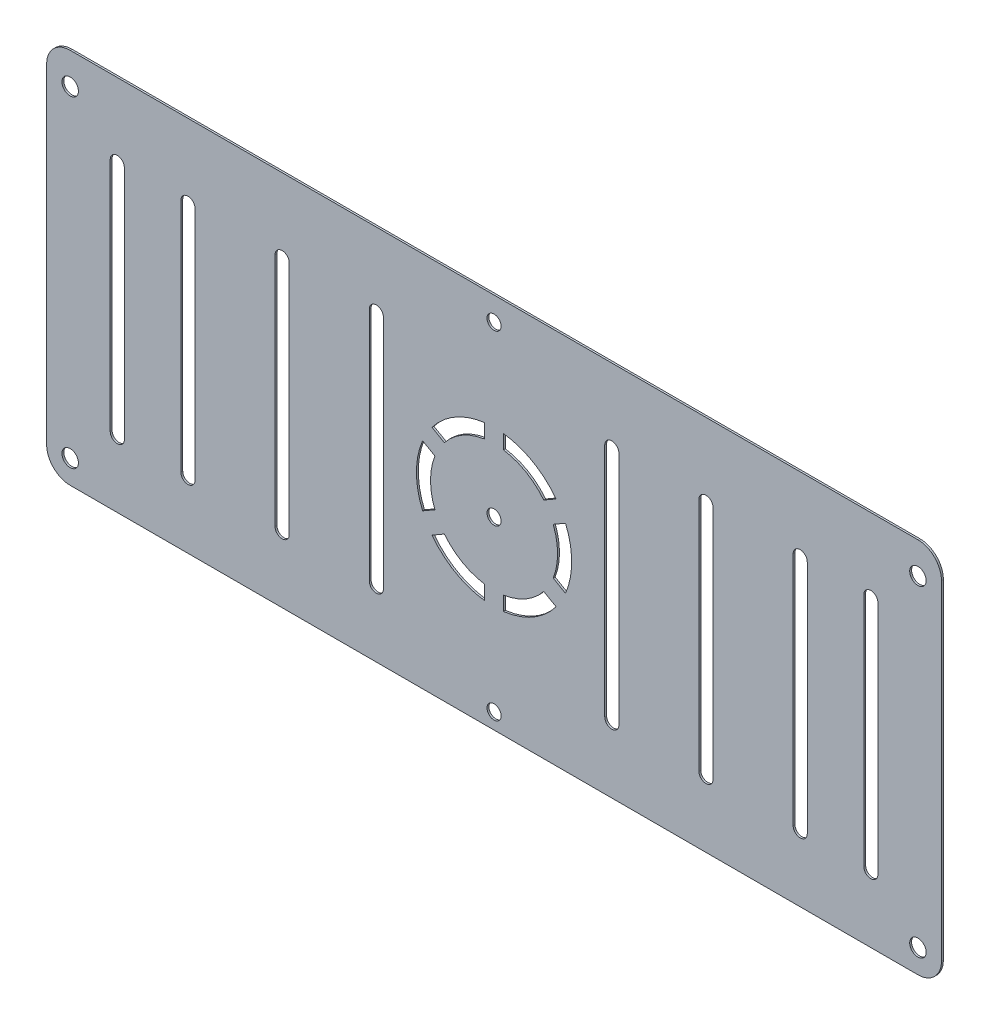
from build123d import *

# Parameters (mm, degrees)
SKETCH_1_R          = 1.75
SKETCH_1_R_2        = 1.5
EXTRUDE_1_DEPTH     = 0.4
SKETCH_2_R          = 1.5
CUT_EXTRUDE_1_DEPTH = 10


with BuildPart() as part:
    # 草图1 → 凸台-拉伸1 (new body)
    with BuildSketch(Plane.XY):
        with BuildLine():
            Line((90, 40.82885301), (-90, 40.82885301))
            ThreePointArc((-90, 40.82885301), (-93.535533906, 39.364386916), (-95, 35.82885301))
            Line((-95, 35.82885301), (-95, -34.17114699))
            ThreePointArc((-95, -34.17114699), (-93.535533906, -37.706680896), (-90, -39.17114699))
            Line((-90, -39.17114699), (90, -39.17114699))
            ThreePointArc((90, -39.17114699), (93.535533906, -37.706680896), (95, -34.17114699))
            Line((95, -34.17114699), (95, 35.82885301))
            ThreePointArc((95, 35.82885301), (93.535533906, 39.364386916), (90, 40.82885301))
        make_face()
        with Locations((-90, -34.17114699)):
            Circle(SKETCH_1_R, mode=Mode.SUBTRACT)
        with BuildLine():
            ThreePointArc((-78.5, -25), (-80, -26.5), (-81.5, -25))
            Line((-81.5, -25), (-81.5, 25))
            ThreePointArc((-81.5, 25), (-80, 26.5), (-78.5, 25))
            Line((-78.5, 25), (-78.5, -25))
        make_face(mode=Mode.SUBTRACT)
        with BuildLine():
            ThreePointArc((-63.5, -25), (-65, -26.5), (-66.5, -25))
            Line((-66.5, -25), (-66.5, 25))
            ThreePointArc((-66.5, 25), (-65, 26.5), (-63.5, 25))
            Line((-63.5, 25), (-63.5, -25))
        make_face(mode=Mode.SUBTRACT)
        with BuildLine():
            ThreePointArc((-43.5, -25), (-45, -26.5), (-46.5, -25))
            Line((-46.5, -25), (-46.5, 25))
            ThreePointArc((-46.5, 25), (-45, 26.5), (-43.5, 25))
            Line((-43.5, 25), (-43.5, -25))
        make_face(mode=Mode.SUBTRACT)
        with BuildLine():
            ThreePointArc((-23.5, -25), (-25, -26.5), (-26.5, -25))
            Line((-26.5, -25), (-26.5, 25))
            ThreePointArc((-26.5, 25), (-25, 26.5), (-23.5, 25))
            Line((-23.5, 25), (-23.5, -25))
        make_face(mode=Mode.SUBTRACT)
        with Locations((0, -35.82885301)):
            Circle(SKETCH_1_R_2, mode=Mode.SUBTRACT)
        with Locations((90, -34.17114699)):
            Circle(SKETCH_1_R, mode=Mode.SUBTRACT)
        with BuildLine():
            Line((-2, 16.362465919), (-2, 13.344643459))
            ThreePointArc((-2, 13.344643459), (-6.746842021, 11.685873172), (-10.55680024, 8.404372537))
            Line((-10.55680024, 8.404372537), (-13.170311155, 9.913283767))
            ThreePointArc((-13.170311155, 9.913283767), (-8.242121859, 14.275773822), (-2, 16.362465919))
        make_face(mode=Mode.SUBTRACT)
        with BuildLine():
            ThreePointArc((-12.55680024, 4.940270922), (-13.493684043, 0), (-12.55680024, -4.940270922))
            Line((-12.55680024, -4.940270922), (-15.170311155, -6.449182152))
            ThreePointArc((-15.170311155, -6.449182152), (-16.484243718, 0), (-15.170311155, 6.449182152))
            Line((-15.170311155, 6.449182152), (-12.55680024, 4.940270922))
        make_face(mode=Mode.SUBTRACT)
        with BuildLine():
            ThreePointArc((-10.55680024, -8.404372537), (-6.746842021, -11.685873172), (-2, -13.344643459))
            Line((-2, -13.344643459), (-2, -16.362465919))
            ThreePointArc((-2, -16.362465919), (-8.242121859, -14.275773822), (-13.170311155, -9.913283767))
            Line((-13.170311155, -9.913283767), (-10.55680024, -8.404372537))
        make_face(mode=Mode.SUBTRACT)
        with BuildLine():
            ThreePointArc((2, -13.344643459), (6.746842021, -11.685873172), (10.55680024, -8.404372537))
            Line((10.55680024, -8.404372537), (13.170311155, -9.913283767))
            ThreePointArc((13.170311155, -9.913283767), (8.242121859, -14.275773822), (2, -16.362465919))
            Line((2, -16.362465919), (2, -13.344643459))
        make_face(mode=Mode.SUBTRACT)
        with BuildLine():
            ThreePointArc((12.55680024, -4.940270922), (13.493684043, 0), (12.55680024, 4.940270922))
            Line((12.55680024, 4.940270922), (15.170311155, 6.449182152))
            ThreePointArc((15.170311155, 6.449182152), (16.484243718, 0), (15.170311155, -6.449182152))
            Line((15.170311155, -6.449182152), (12.55680024, -4.940270922))
        make_face(mode=Mode.SUBTRACT)
        with BuildLine():
            ThreePointArc((10.55680024, 8.404372537), (6.746842021, 11.685873172), (2, 13.344643459))
            Line((2, 13.344643459), (2, 16.362465919))
            ThreePointArc((2, 16.362465919), (8.242121859, 14.275773822), (13.170311155, 9.913283767))
            Line((13.170311155, 9.913283767), (10.55680024, 8.404372537))
        make_face(mode=Mode.SUBTRACT)
        with BuildLine():
            ThreePointArc((26.5, -25), (25, -26.5), (23.5, -25))
            Line((23.5, -25), (23.5, 25))
            ThreePointArc((23.5, 25), (25, 26.5), (26.5, 25))
            Line((26.5, 25), (26.5, -25))
        make_face(mode=Mode.SUBTRACT)
        with BuildLine():
            ThreePointArc((46.5, -25), (45, -26.5), (43.5, -25))
            Line((43.5, -25), (43.5, 25))
            ThreePointArc((43.5, 25), (45, 26.5), (46.5, 25))
            Line((46.5, 25), (46.5, -25))
        make_face(mode=Mode.SUBTRACT)
        with BuildLine():
            ThreePointArc((66.5, -25), (65, -26.5), (63.5, -25))
            Line((63.5, -25), (63.5, 25))
            ThreePointArc((63.5, 25), (65, 26.5), (66.5, 25))
            Line((66.5, 25), (66.5, -25))
        make_face(mode=Mode.SUBTRACT)
        with BuildLine():
            Line((81.5, 25), (81.5, -25))
            ThreePointArc((81.5, -25), (80, -26.5), (78.5, -25))
            Line((78.5, -25), (78.5, 25))
            ThreePointArc((78.5, 25), (80, 26.5), (81.5, 25))
        make_face(mode=Mode.SUBTRACT)
        with Locations((-90, 34.17114699)):
            Circle(SKETCH_1_R, mode=Mode.SUBTRACT)
        with Locations((0, 35.82885301)):
            Circle(SKETCH_1_R_2, mode=Mode.SUBTRACT)
        with Locations((90, 34.17114699)):
            Circle(SKETCH_1_R, mode=Mode.SUBTRACT)
    extrude(amount=EXTRUDE_1_DEPTH)

    # 草图2 → 切除-拉伸1 (cut)
    with BuildSketch(Plane.XY.offset(0.4)):
        Circle(SKETCH_2_R)
    extrude(amount=-CUT_EXTRUDE_1_DEPTH, mode=Mode.SUBTRACT)


solid = part.part
